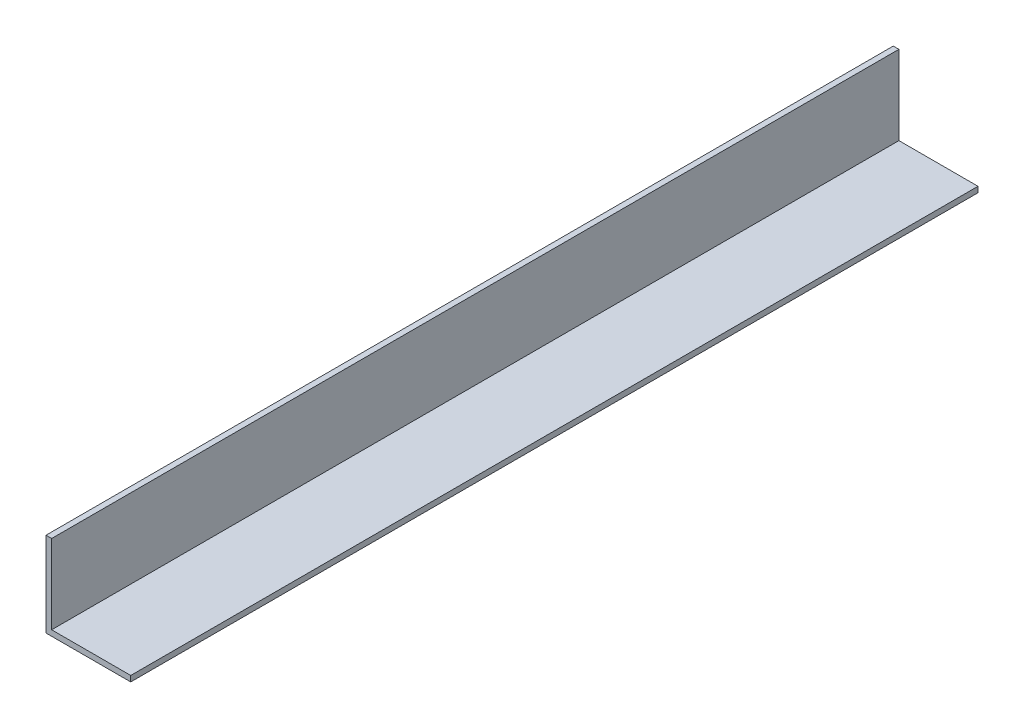
from build123d import *

# Parameters (mm, degrees)
BOSS_EXTRUDE1_DEPTH = 300


with BuildPart() as part:
    # Sketch1 → Boss-Extrude1 (new body)
    with BuildSketch(Plane.XY):
        Polygon((0, 0), (0, 30), (2, 30), (2, 2), (30, 2), (30, 0), align=None)
    extrude(amount=-BOSS_EXTRUDE1_DEPTH)


solid = part.part
